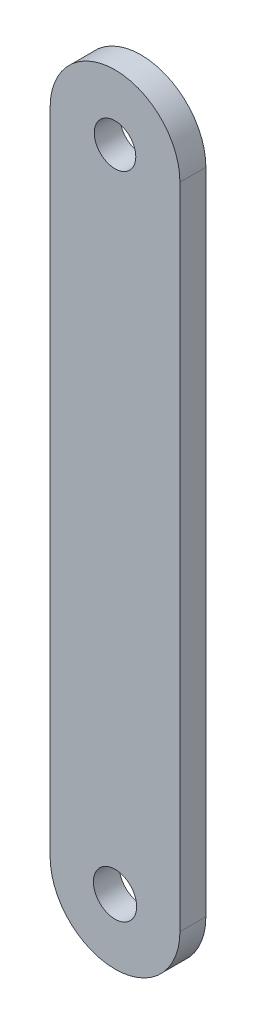
from build123d import *

# Parameters (mm, degrees)
SKETCH1_R           = 2.5
SKETCH1_R_2         = 2.4
BOSS_EXTRUDE1_DEPTH = 3


with BuildPart() as part:
    # Sketch1 → Boss-Extrude1 (new body)
    with BuildSketch(Plane.XY):
        with BuildLine():
            Line((185.825363728, 60.532913208), (185.825363728, 135.532913208))
            ThreePointArc((185.825363728, 135.532913208), (193.325363728, 143.032913208), (200.825363728, 135.532913208))
            Line((200.825363728, 135.532913208), (200.825363728, 60.532913208))
            ThreePointArc((200.825363728, 60.532913208), (193.325363728, 53.032913208), (185.825363728, 60.532913208))
        make_face()
        with Locations((193.325363728, 60.532913208)):
            Circle(SKETCH1_R, mode=Mode.SUBTRACT)
        with Locations((193.325363728, 135.532913208)):
            Circle(SKETCH1_R_2, mode=Mode.SUBTRACT)
    extrude(amount=BOSS_EXTRUDE1_DEPTH)


solid = part.part
